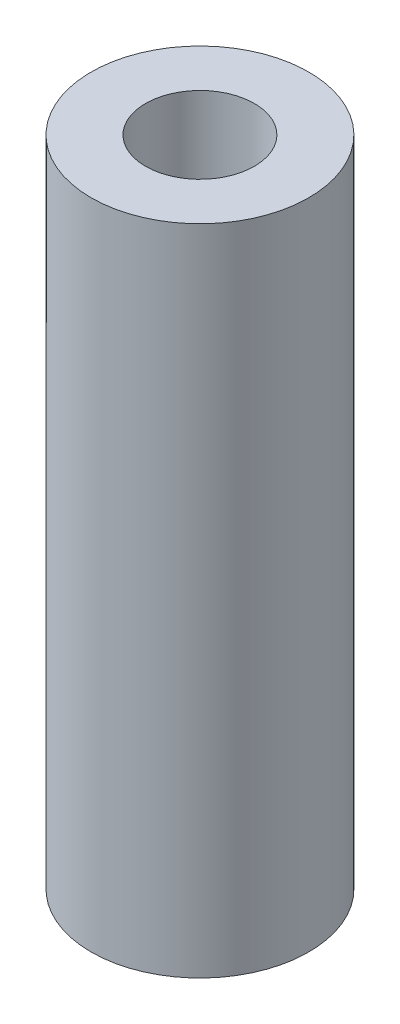
from build123d import *

# Parameters (mm, degrees)
SKETCH1_R           = 2.5
SKETCH1_R_2         = 1.25
BOSS_EXTRUDE1_DEPTH = 15


with BuildPart() as part:
    # Sketch1 → Boss-Extrude1 (new body)
    with BuildSketch(Plane(origin=(0, 0, 0), x_dir=(1, 0, 0), z_dir=(0, 1, 0))):
        with Locations(Location((0, 0, 0), (0, 0, 270))):
            Circle(SKETCH1_R)
        with Locations(Location((0, 0, 0), (0, 0, 270))):
            Circle(SKETCH1_R_2, mode=Mode.SUBTRACT)
    extrude(amount=BOSS_EXTRUDE1_DEPTH)


solid = part.part
